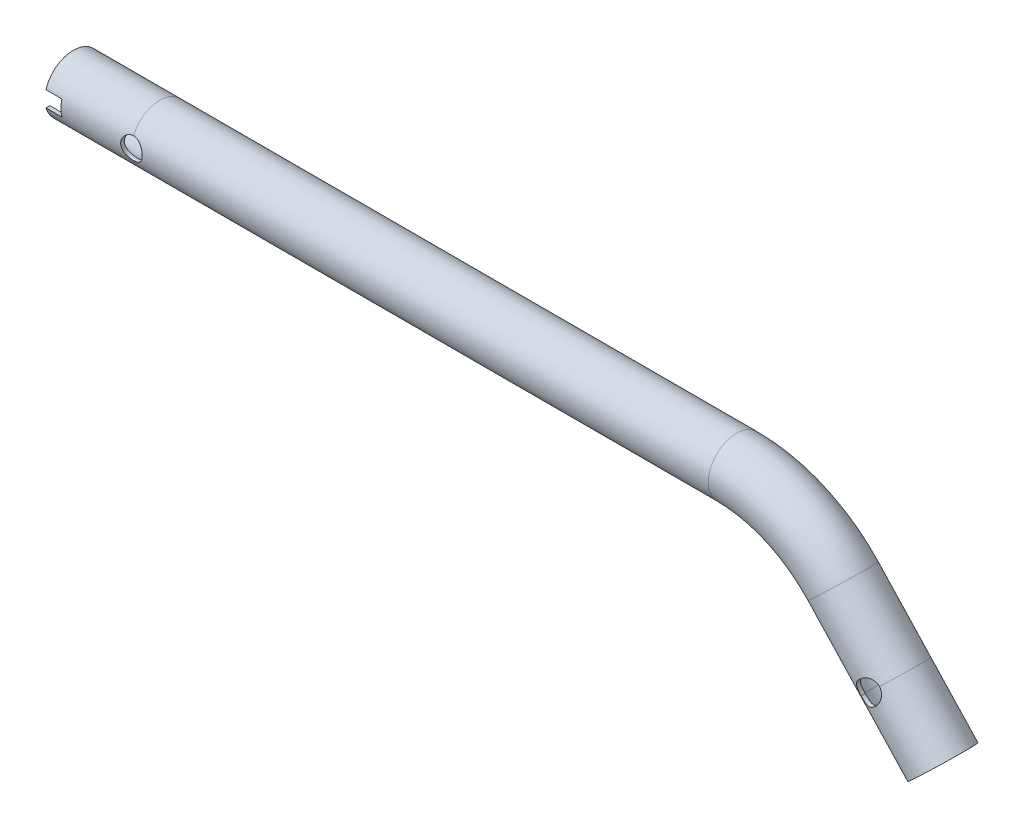
from build123d import *

# Parameters (mm, degrees)
SKETCH2_R                      = 9.25
SKETCH2_R_2                    = 8.05
CUT_EXTRUDE1_REACH             = 270.29
CUT_EXTRUDE1_DIRECTION_2_REACH = 270.29
CUT_EXTRUDE2_REACH             = 270.29
CUT_EXTRUDE2_END_RADIUS        = 9.25
SKETCH4_R                      = 3.5
CUT_EXTRUDE3_DEPTH             = 269.290193288
CUT_EXTRUDE3_DEPTH_BACK        = 269.290193288


with BuildPart() as part:
    # Sweep1: sweep along a path in Sketch1
    with BuildLine(Plane.XY) as sweep1_path:
        Line((-28.215582401, 0), (0, 0))
        Line((0, 0), (188.107156804, 0))
        ThreePointArc((188.107156804, 0), (207.047737578, -3.939646467), (222.846457631, -15.105077897))
        Line((222.846457631, -15.105077897), (240, -33.5))
        Line((240, -33.5), (255.386498921, -50))
    # Sketch2 → Sweep1 (sweep)
    with BuildSketch(Plane.ZY.offset(28.215582401)):
        Circle(SKETCH2_R)
        Circle(SKETCH2_R_2, mode=Mode.SUBTRACT)
    sweep(path=sweep1_path.line)

    # Sketch3 → Cut-Extrude1 (cut, up to next)
    with BuildSketch(Plane.XY, mode=Mode.PRIVATE) as cut_extrude1_sk1:
        with BuildLine():
            Line((243.055538772, -30.76491951), (242.941561581, -30.642693937))
            ThreePointArc((242.941561581, -30.642693937), (240.503971864, -29.531820303), (237.994829366, -30.469950242))
            Line((237.994829366, -30.469950242), (237.117204924, -31.288348274))
            ThreePointArc((237.117204924, -31.288348274), (236.006331289, -33.725937991), (236.944461228, -36.23508049))
            Line((236.944461228, -36.23508049), (237.058438419, -36.357306063))
            ThreePointArc((237.058438419, -36.357306063), (239.496028136, -37.468179697), (242.005170634, -36.530049758))
            Line((242.005170634, -36.530049758), (242.882795076, -35.711651726))
            ThreePointArc((242.882795076, -35.711651726), (243.993668711, -33.274062009), (243.055538772, -30.76491951))
        make_face()
    cut_extrude1_tool1 = extrude(cut_extrude1_sk1.sketch, amount=-CUT_EXTRUDE1_REACH, mode=Mode.PRIVATE) & part.part
    add(cut_extrude1_tool1.solids().sort_by_distance((240, -33.5, 0))[0], mode=Mode.SUBTRACT)

    # Sketch3 → Cut-Extrude1 direction 2 (cut, up to next)
    with BuildSketch(Plane.XY, mode=Mode.PRIVATE) as cut_extrude1_direction_2_sk1:
        with BuildLine():
            Line((243.055538772, -30.76491951), (242.941561581, -30.642693937))
            ThreePointArc((242.941561581, -30.642693937), (240.503971864, -29.531820303), (237.994829366, -30.469950242))
            Line((237.994829366, -30.469950242), (237.117204924, -31.288348274))
            ThreePointArc((237.117204924, -31.288348274), (236.006331289, -33.725937991), (236.944461228, -36.23508049))
            Line((236.944461228, -36.23508049), (237.058438419, -36.357306063))
            ThreePointArc((237.058438419, -36.357306063), (239.496028136, -37.468179697), (242.005170634, -36.530049758))
            Line((242.005170634, -36.530049758), (242.882795076, -35.711651726))
            ThreePointArc((242.882795076, -35.711651726), (243.993668711, -33.274062009), (243.055538772, -30.76491951))
        make_face()
    cut_extrude1_direction_2_tool1 = extrude(cut_extrude1_direction_2_sk1.sketch, amount=CUT_EXTRUDE1_DIRECTION_2_REACH, mode=Mode.PRIVATE) & part.part
    add(cut_extrude1_direction_2_tool1.solids().sort_by_distance((240, -33.5, 0))[0], mode=Mode.SUBTRACT)

    # Cut-Extrude2: up to this cylinder (the profile starts inside it)
    cut_extrude2_end = Plane(origin=(0, 0, 0), z_dir=(-1, 0, 0)) * Cylinder(CUT_EXTRUDE2_END_RADIUS, 560.08, mode=Mode.PRIVATE)
    # Sketch4 → Cut-Extrude2 (cut, up to the surface)
    with BuildSketch(Plane.XY, mode=Mode.PRIVATE) as cut_extrude2_sk1:
        with Locations(Location((0, 0, 0), (0, 0, 90))):
            Circle(SKETCH4_R)
    cut_extrude2_tool1 = extrude(cut_extrude2_sk1.sketch, amount=CUT_EXTRUDE2_REACH, mode=Mode.PRIVATE) & cut_extrude2_end
    add(cut_extrude2_tool1.solids().sort_by_distance((0, 0, 0))[0], mode=Mode.SUBTRACT)

    # Sketch5 → Cut-Extrude3 (cut, two sides: drawn at the far end of the back side and taken through both)
    with BuildSketch(Plane.XY.offset(-CUT_EXTRUDE3_DEPTH_BACK)):
        Polygon((-28.215582401, 0), (-28.215582401, 2.555), (-23.015582401, 2.555), (-23.015582401, -2.555), (-28.215582401, -2.555), align=None)
    extrude(amount=CUT_EXTRUDE3_DEPTH + CUT_EXTRUDE3_DEPTH_BACK, mode=Mode.SUBTRACT)


solid = part.part
